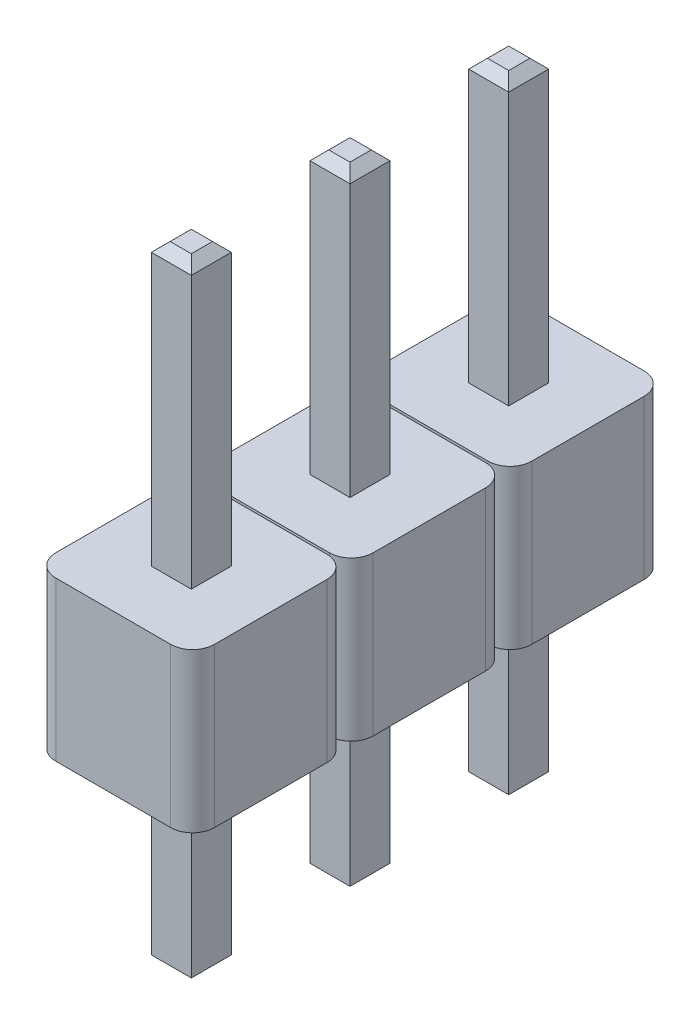
from build123d import *

# Parameters (mm, degrees)
SKETCH1_W           = 0.64
SKETCH1_H           = 0.64
BOSS_EXTRUDE1_DEPTH = 10.04
CHAMFER1_SIZE       = 0.15
BOSS_EXTRUDE2_DEPTH = 2.54
LPATTERN2_COUNT     = 3
LPATTERN2_PITCH     = 2.54


with BuildPart() as part:
    # Sketch1 → Boss-Extrude1 (new body)
    with BuildSketch(Plane(origin=(0, 0, 0), x_dir=(1, 0, 0), z_dir=(0, 1, 0))):
        with Locations((0.32, 0.32)):
            Rectangle(SKETCH1_W, SKETCH1_H)
    extrude(amount=BOSS_EXTRUDE1_DEPTH)

    # Chamfer1
    chamfer1_edges = [part.edges().sort_by_distance(p)[0] for p in [
        (0.32, 0, 0),
        (0.64, 0, -0.32),
        (0.32, 0, -0.64),
        (0, 0, -0.32),
        (0.32, 10.04, -0.64),
        (0.64, 10.04, -0.32),
        (0.32, 10.04, 0),
        (0, 10.04, -0.32),
    ]]
    chamfer(chamfer1_edges, length=CHAMFER1_SIZE)

    # Sketch3 → Boss-Extrude2 (add)
    with BuildSketch(Plane(origin=(0, 5.54, 0), x_dir=(1, 0, 0), z_dir=(0, 1, 0))):
        with BuildLine():
            Line((-0.6, -0.93), (1.24, -0.93))
            ThreePointArc((1.24, -0.93), (1.487487373, -0.827487373), (1.59, -0.58))
            Line((1.59, -0.58), (1.59, 1.22))
            ThreePointArc((1.59, 1.22), (1.487487373, 1.467487373), (1.24, 1.57))
            Line((1.24, 1.57), (-0.6, 1.57))
            ThreePointArc((-0.6, 1.57), (-0.847487373, 1.467487373), (-0.95, 1.22))
            Line((-0.95, 1.22), (-0.95, -0.58))
            ThreePointArc((-0.95, -0.58), (-0.847487373, -0.827487373), (-0.6, -0.93))
        make_face()
    extrude(amount=-BOSS_EXTRUDE2_DEPTH)


with BuildPart() as lpattern2_1:
    # LPattern2: pattern copy
    add(part.part.moved(Location(Vector(0, 0, -1) * (1 * LPATTERN2_PITCH))))


with BuildPart() as lpattern2_2:
    # LPattern2: pattern copy
    add(part.part.moved(Location(Vector(0, 0, -1) * (2 * LPATTERN2_PITCH))))


solid = Compound([part.part, lpattern2_1.part, lpattern2_2.part])
